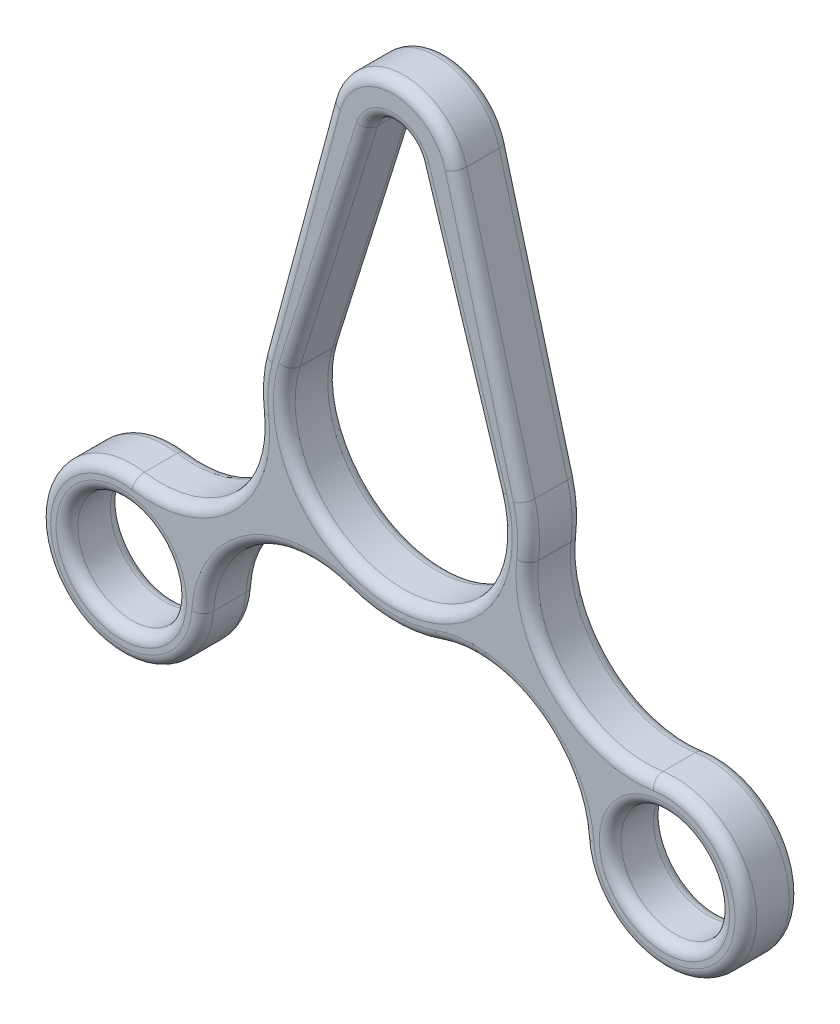
from build123d import *

# Parameters (mm, degrees)
SKETCH1_R           = 10
BOSS_EXTRUDE1_DEPTH = 5
FILLET1_R           = 2


with BuildPart() as part:
    # Sketch1 → Boss-Extrude1 (new, symmetric)
    with BuildSketch(Plane.XY):
        with BuildLine():
            Line((-11.587303396, 53.12), (-24.140215409, 6.5))
            ThreePointArc((-24.140215409, 6.5), (-24.936514863, 1.780512988), (-24.81883517, -3.004233816))
            ThreePointArc((-24.81883517, -3.004233816), (-30.762049538, -19.776348187), (-47.717387131, -25.174694658))
            ThreePointArc((-47.717387131, -25.174694658), (-61.713032142, -49.370425713), (-35.03522611, -41.027395935))
            ThreePointArc((-35.03522611, -41.027395935), (-26.046643252, -25.670606045), (-8.378996809, -23.554031767))
            ThreePointArc((-8.378996809, -23.554031767), (0, -25), (8.378996809, -23.554031767))
            ThreePointArc((8.378996809, -23.554031767), (26.046643252, -25.670606045), (35.03522611, -41.027395935))
            ThreePointArc((35.03522611, -41.027395935), (61.713032142, -49.370425713), (47.717387131, -25.174694658))
            ThreePointArc((47.717387131, -25.174694658), (30.762049538, -19.776348187), (24.81883517, -3.004233816))
            ThreePointArc((24.81883517, -3.004233816), (24.936514863, 1.780512988), (24.140215409, 6.5))
            Line((24.140215409, 6.5), (11.587303396, 53.12))
            ThreePointArc((11.587303396, 53.12), (0, 62), (-11.587303396, 53.12))
        make_face()
        with Locations((50, -40)):
            Circle(SKETCH1_R, mode=Mode.SUBTRACT)
        with Locations(Location((-50, -40, 0), (0, 0, 180))):
            Circle(SKETCH1_R, mode=Mode.SUBTRACT)
        with BuildLine():
            Line((-4.769696007, 51.5), (-19.078784028, 6))
            ThreePointArc((-19.078784028, 6), (0, -20), (19.078784028, 6))
            Line((19.078784028, 6), (4.769696007, 51.5))
            ThreePointArc((4.769696007, 51.5), (0, 55), (-4.769696007, 51.5))
        make_face(mode=Mode.SUBTRACT)
    extrude(amount=BOSS_EXTRUDE1_DEPTH, both=True)

    # Fillet1
    fillet1_edges = [part.edges().sort_by_distance(p)[0] for p in [
        (17.863759403, 29.81, -5),
        (24.936514863, 1.780512988, -5),
        (-24.936514863, 1.780512988, 5),
        (30.762049538, -19.776348187, -5),
        (61.713032142, -49.370425713, -5),
        (26.046643252, -25.670606045, -5),
        (0, -25, -5),
        (-26.046643252, -25.670606045, -5),
        (-61.713032142, -49.370425713, -5),
        (-30.762049538, -19.776348187, -5),
        (-24.936514863, 1.780512988, -5),
        (-17.863759403, 29.81, -5),
        (0, 62, -5),
        (-30.762049538, -19.776348187, 5),
        (-61.713032142, -49.370425713, 5),
        (-26.046643252, -25.670606045, 5),
        (0, -25, 5),
        (40, -40, -5),
        (40, -40, 5),
        (26.046643252, -25.670606045, 5),
        (-40, -40, -5),
        (-40, -40, 5),
        (61.713032142, -49.370425713, 5),
        (30.762049538, -19.776348187, 5),
        (0, 55, -5),
        (-11.924240018, 28.75, -5),
        (0, -20, -5),
        (11.924240018, 28.75, -5),
        (0, 55, 5),
        (-11.924240018, 28.75, 5),
        (0, -20, 5),
        (11.924240018, 28.75, 5),
        (24.936514863, 1.780512988, 5),
        (17.863759403, 29.81, 5),
        (0, 62, 5),
        (-17.863759403, 29.81, 5),
    ]]
    fillet(fillet1_edges, radius=FILLET1_R)


solid = part.part
